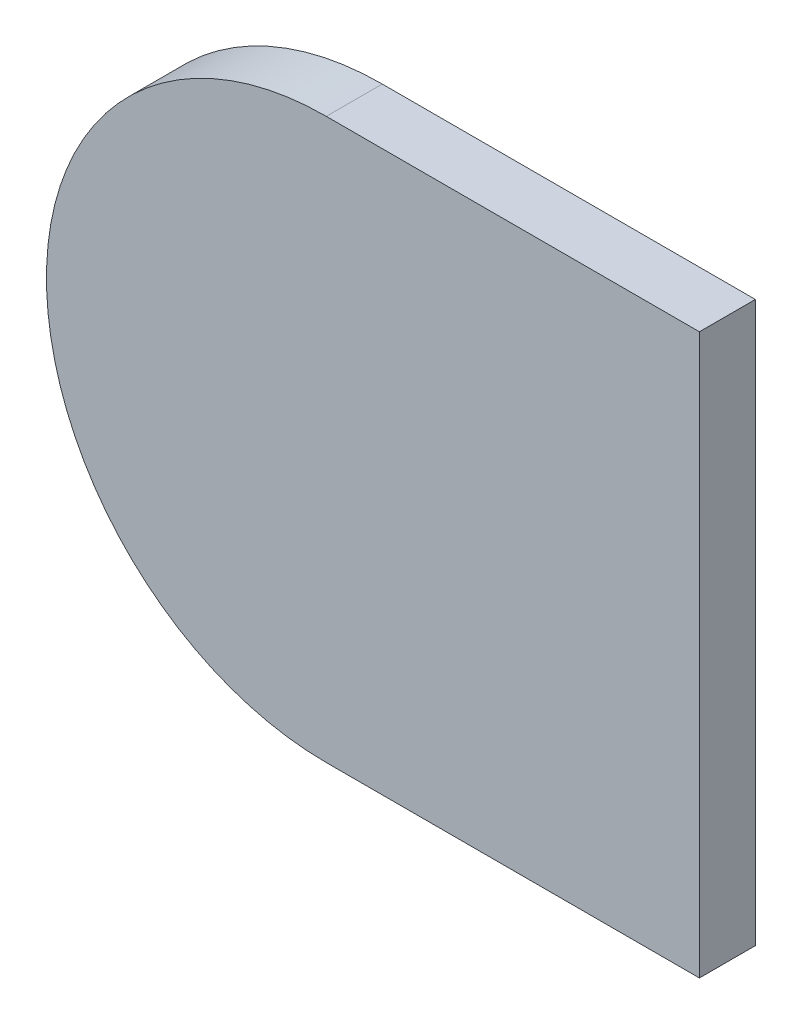
from build123d import *

# Parameters (mm, degrees)
EXTRUDE_1_DEPTH     = 6
SKETCH_2_R          = 18.75
CUT_EXTRUDE_1_DEPTH = 1


with BuildPart() as part:
    # 草图1 → 凸台-拉伸1 (new body)
    with BuildSketch(Plane.XY):
        with BuildLine():
            Line((0, 30), (40, 30))
            Line((40, 30), (40, -30))
            Line((40, -30), (0, -30))
            ThreePointArc((0, -30), (-30, 0), (0, 30))
        make_face()
    extrude(amount=EXTRUDE_1_DEPTH)

    # 草图2 → 切除-拉伸1 (cut)
    with BuildSketch(Plane(origin=(0, 0, 0), x_dir=(-1, 0, 0), z_dir=(0, 0, -1))):
        Circle(SKETCH_2_R)
    extrude(amount=-CUT_EXTRUDE_1_DEPTH, mode=Mode.SUBTRACT)


solid = part.part
